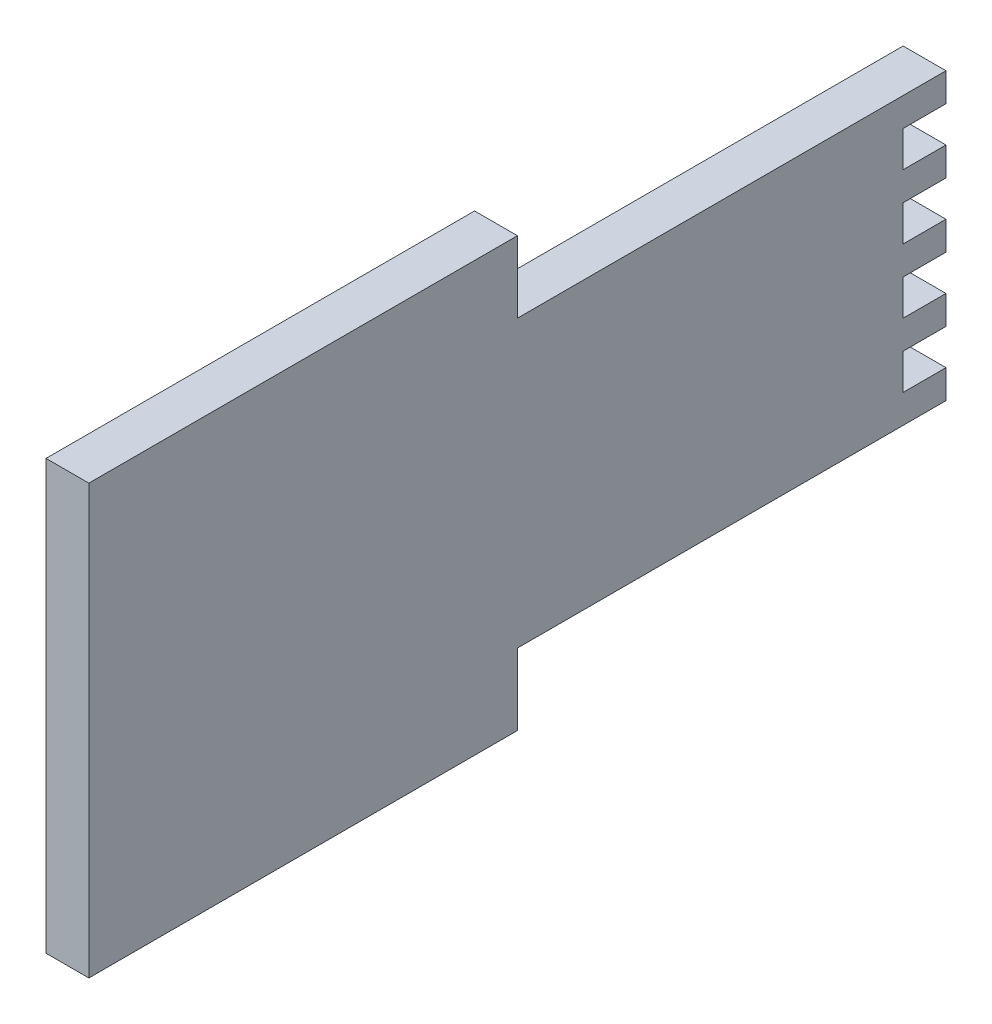
from build123d import *

# Parameters (mm, degrees)
BOSS_EXTRUDE1_DEPTH = 3


with BuildPart() as part:
    # Sketch1 → Boss-Extrude1 (new body)
    with BuildSketch(Plane(origin=(0, 0, 0), x_dir=(0, 0, -1), z_dir=(1, 0, 0))):
        Polygon((30, 10), (0, 10), (0, 15), (-30, 15), (-30, -15), (0, -15), (0, -10), (30, -10), (30, -8), (27, -8), (27, -5.5), (30, -5.5), (30, -3.5), (27, -3.5), (27, -1), (30, -1), (30, 1), (27, 1), (27, 3.5), (30, 3.5), (30, 5.5), (27, 5.5), (27, 8), (30, 8), align=None)
    extrude(amount=BOSS_EXTRUDE1_DEPTH)


solid = part.part
